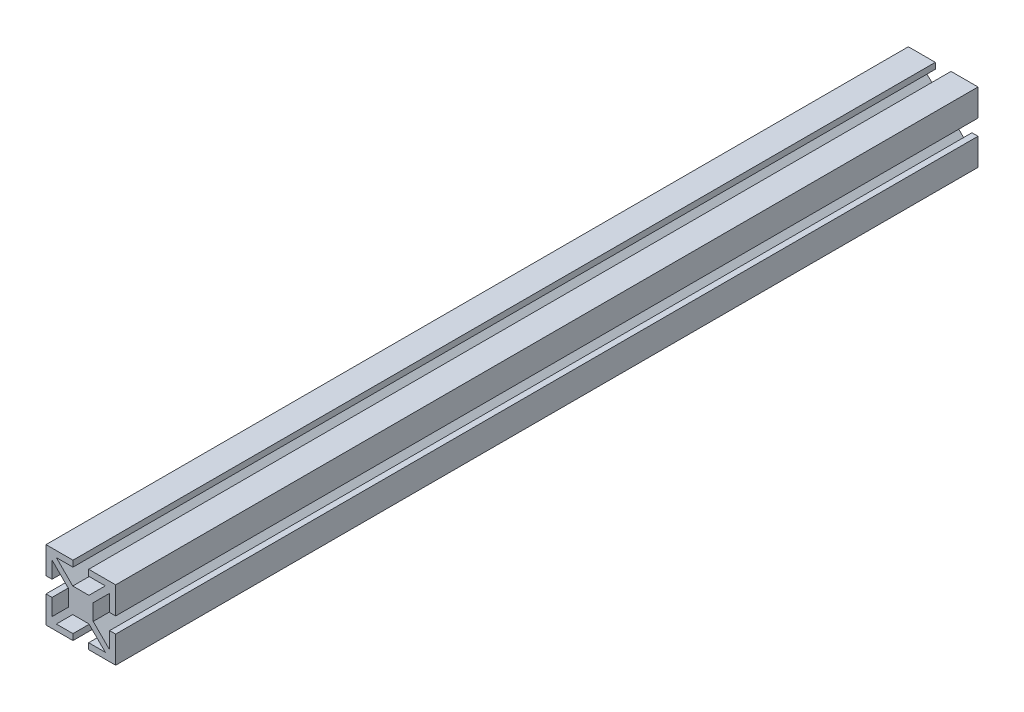
from build123d import *

# Parameters (mm, degrees)
BOSS_EXTRUDE1_DEPTH = 314.452


with BuildPart() as part:
    # Sketch1 → Boss-Extrude1 (new body)
    with BuildSketch(Plane(origin=(11.365010382, -9.846206226, 0), x_dir=(1, 0, 0), z_dir=(0, 0, 1))):
        Polygon((-24.065010382, 22.546206226), (-14.229795365, 22.546206226), (-14.229795365, 20.336406226), (-20.292645817, 20.336406226), (-14.310945817, 14.354706226), (-8.419074947, 14.354706226), (-2.437374947, 20.336406226), (-8.5002254, 20.336406226), (-8.5002254, 22.546206226), (1.334989618, 22.546206226), (1.334989618, 12.710991208), (-0.874810382, 12.710991208), (-0.874810382, 18.773841661), (-6.856510382, 12.792141661), (-6.856510382, 6.900270791), (-0.874810382, 0.918570791), (-0.874810382, 6.981421243), (1.334989618, 6.981421243), (1.334989618, -2.853793774), (-8.5002254, -2.853793774), (-8.5002254, -0.643993774), (-2.437374947, -0.643993774), (-8.419074947, 5.337706226), (-14.310945817, 5.337706226), (-20.292645817, -0.643993774), (-14.229795365, -0.643993774), (-14.229795365, -2.853793774), (-24.065010382, -2.853793774), (-24.065010382, 6.981421243), (-21.855210382, 6.981421243), (-21.855210382, 0.918570791), (-15.873510382, 6.900270791), (-15.873510382, 12.792141661), (-21.855210382, 18.773841661), (-21.855210382, 12.710991208), (-24.065010382, 12.710991208), align=None)
    extrude(amount=BOSS_EXTRUDE1_DEPTH)


solid = part.part
